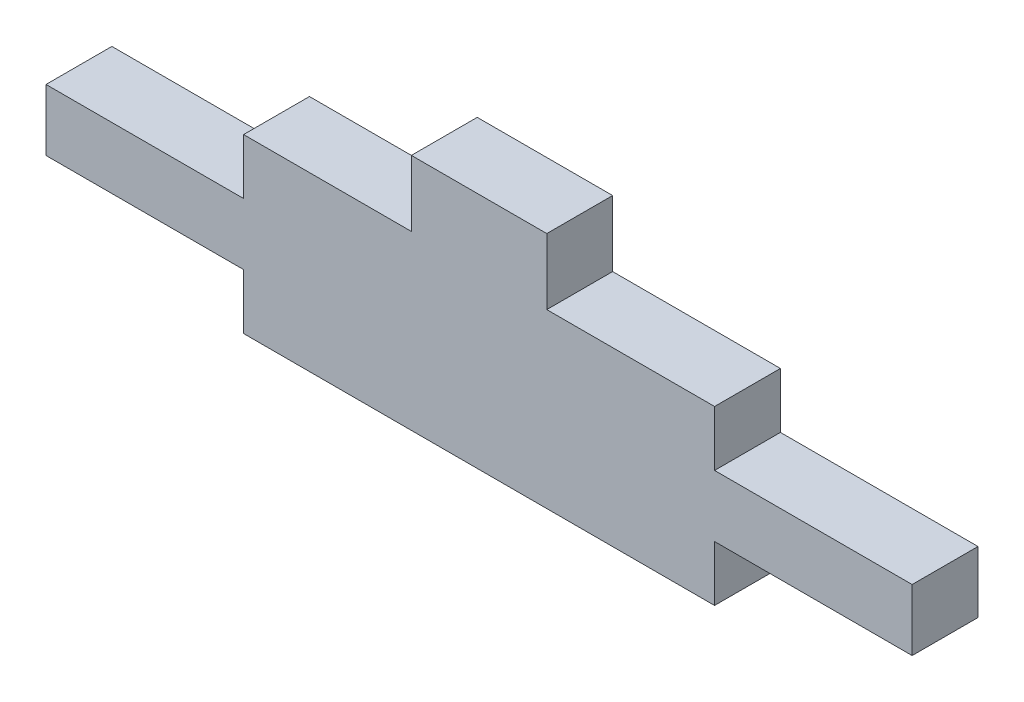
from build123d import *

# Parameters (mm, degrees)
BOSS_EXTRUDE1_DEPTH = 5.35


with BuildPart() as part:
    # Model → Boss-Extrude1 (new body)
    with BuildSketch(Plane.XY):
        Polygon((29.680000618, 19.349999726), (29.680000618, 14.000000432), (16.049999744, 14.000000432), (16.049999744, 9.499999695), (0, 9.499999695), (0, 4.499999806), (16.049999744, 4.499999806), (16.049999744, 0), (54.310000502, 0), (54.310000502, 4.499999806), (70.360001177, 4.499999806), (70.360001177, 9.499999695), (54.310000501, 9.499999695), (54.310000501, 14.000000432), (40.680000442, 14.000000432), (40.680000442, 19.349999726), align=None)
    extrude(amount=BOSS_EXTRUDE1_DEPTH)


solid = part.part
